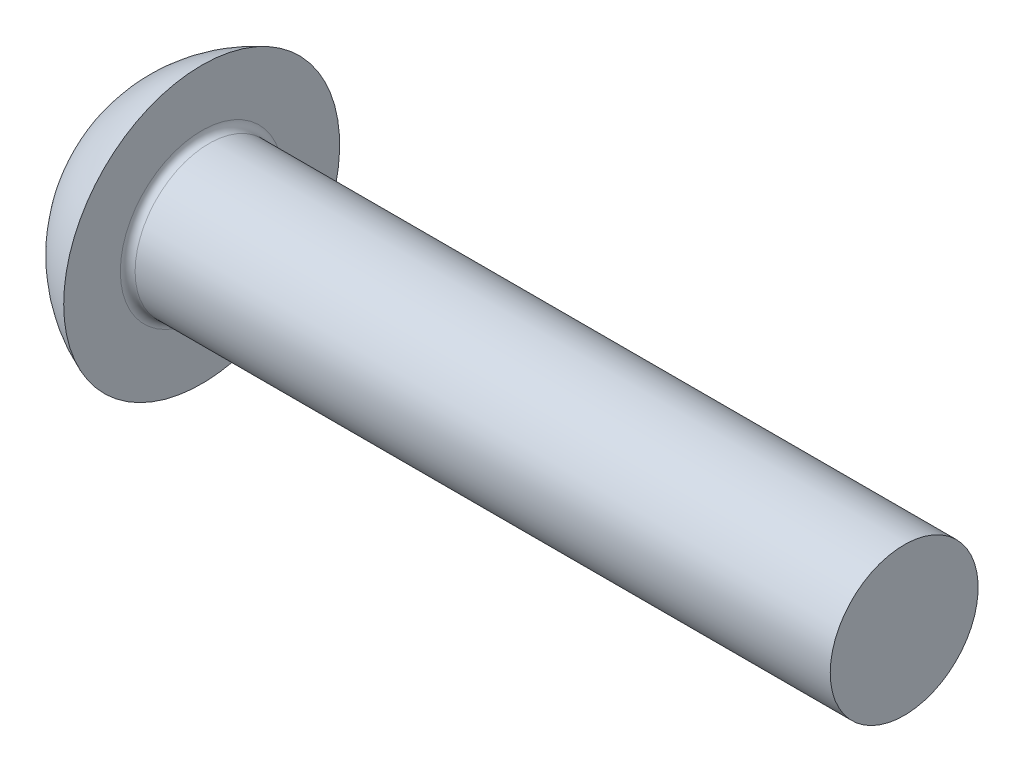
from build123d import *


with BuildPart() as part:
    # 草图1 → Revolve 496 (revolve)
    with BuildSketch(Plane.XY, mode=Mode.PRIVATE) as revolve_496_sk:
        with BuildLine():
            Line((3.84, 5.597713819), (3.84, 3.3))
            ThreePointArc((3.84, 3.3), (3.927867966, 3.087867966), (4.14, 3))
            Line((4.14, 3), (32.34, 3))
            Line((32.34, 3), (32.34, 0))
            Line((32.34, 0), (0, 0))
            ThreePointArc((0, 0), (1.052273249, 3.39411255), (3.84, 5.597713819))
        make_face()
    revolve(revolve_496_sk.sketch.rotate(Axis((-30.73022942, 0, 0), (1, 0, 0)), 90), axis=Axis((-30.73022942, 0, 0), (1, 0, 0)))


solid = part.part
